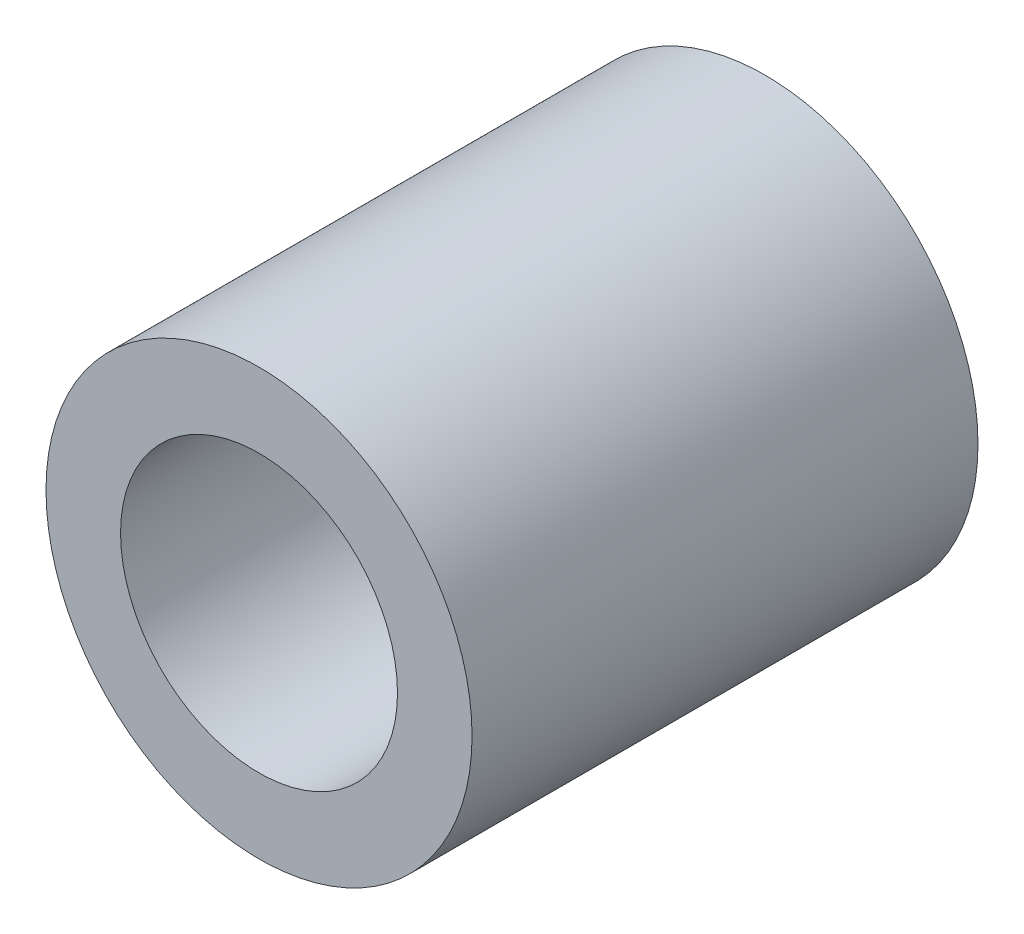
from build123d import *

# Parameters (mm, degrees)
CROQUIS1_R              = 4
CROQUIS1_R_2            = 2.6
SALIENTE_EXTRUIR1_DEPTH = 9.5


with BuildPart() as part:
    # Croquis1 → Saliente-Extruir1 (new body)
    with BuildSketch(Plane.XY):
        Circle(CROQUIS1_R)
        Circle(CROQUIS1_R_2, mode=Mode.SUBTRACT)
    extrude(amount=SALIENTE_EXTRUIR1_DEPTH)


solid = part.part
